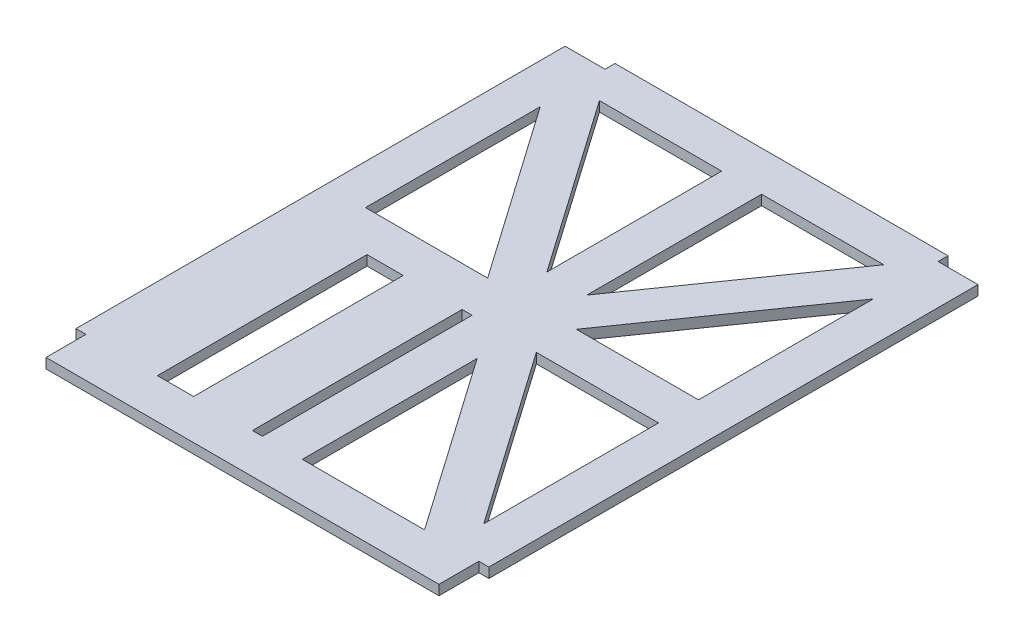
from build123d import *

# Parameters (mm, degrees)
SKETCH1_W           = 11.5
SKETCH1_H           = 66.675
SKETCH1_W_2         = 3.175
BOSS_EXTRUDE1_DEPTH = 3.175


with BuildPart() as part:
    # Sketch1 → Boss-Extrude1 (new body)
    with BuildSketch(Plane(origin=(0, 0, 0), x_dir=(1, 0, 0), z_dir=(0, 1, 0))):
        Polygon((-52.96, 85.881432482), (52.96, 85.881432482), (52.96, 82.706432482), (65.66, 82.706432482), (65.66, -72.868567518), (62.485, -72.868567518), (62.485, -85.568567518), (-62.485, -85.568567518), (-62.485, -72.868567518), (-65.66, -72.868567518), (-65.66, 82.706432482), (-52.96, 82.706432482), align=None)
        Polygon((-52.96, 6.506432482), (-14.097750884, 6.506432482), (-52.96, 62.098375408), align=None, mode=Mode.SUBTRACT)
        Polygon((-45.212249116, 73.181432482), (-6.35, 73.181432482), (-6.35, 17.589489555), align=None, mode=Mode.SUBTRACT)
        with Locations((-34.0045, -39.531067518)):
            Rectangle(SKETCH1_W, SKETCH1_H, mode=Mode.SUBTRACT)
        Polygon((52.96, 62.098375408), (52.96, 6.506432482), (14.097750884, 6.506432482), align=None, mode=Mode.SUBTRACT)
        Polygon((6.35, 73.181432482), (6.35, 17.589489555), (45.212249116, 73.181432482), align=None, mode=Mode.SUBTRACT)
        Polygon((14.097750884, -6.193567518), (52.96, -6.193567518), (52.96, -61.785510445), align=None, mode=Mode.SUBTRACT)
        Polygon((6.35, -17.276624592), (45.212249116, -72.868567518), (6.35, -72.868567518), align=None, mode=Mode.SUBTRACT)
        with Locations((-7.9375, -39.531067518)):
            Rectangle(SKETCH1_W_2, SKETCH1_H, mode=Mode.SUBTRACT)
    extrude(amount=BOSS_EXTRUDE1_DEPTH)


solid = part.part
